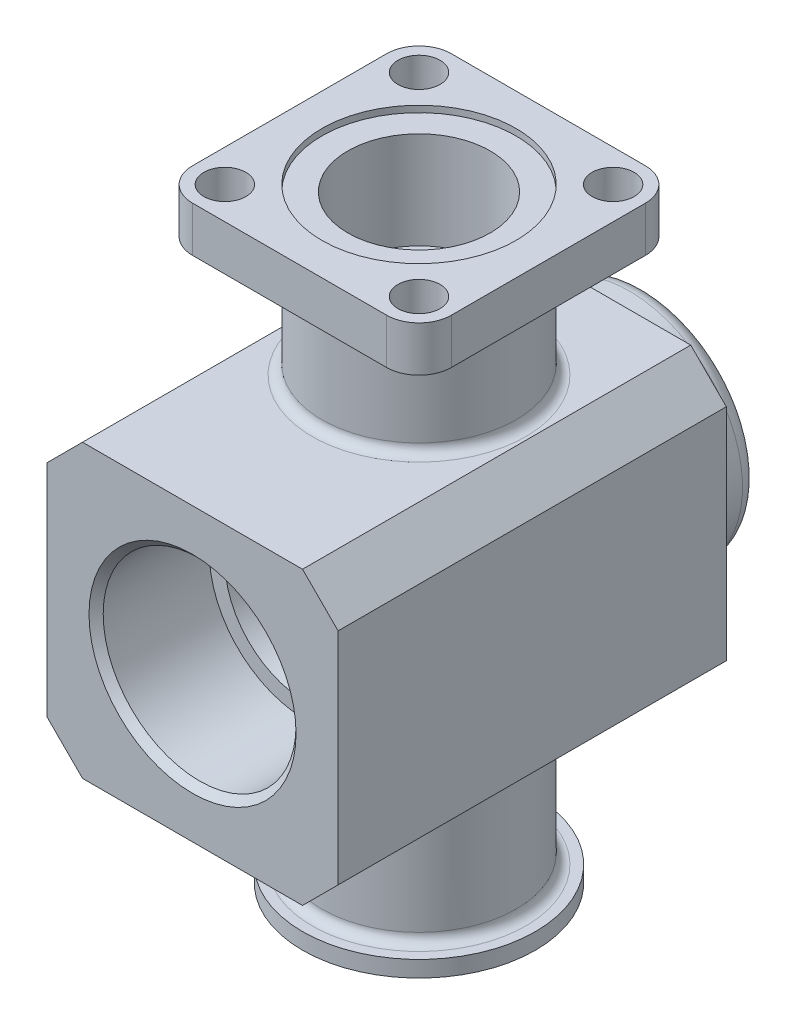
from build123d import *

# Parameters (mm, degrees)
SKETCH_1_W          = 90
SKETCH_1_H          = 90
EXTRUDE_1_DEPTH     = 120
SKETCH_9_R          = 35
EXTRUDE_6_DEPTH     = 20
SKETCH_2_R          = 30
EXTRUDE_2_DEPTH     = 51
SKETCH_3_W          = 80
SKETCH_3_H          = 80
EXTRUDE_3_DEPTH     = 14
EXTRUDE_START       = 46
SKETCH_4_R          = 30
EXTRUDE_4_DEPTH     = 46
SKETCH_5_R          = 36
EXTRUDE_5_DEPTH     = 5
SKETCH_6_R          = 15
CUT_EXTRUDE_1_DEPTH = 227.702448156
SKETCH_7_R          = 22
CUT_EXTRUDE_2_DEPTH = 32
SKETCH_8_R          = 22.352
CUT_EXTRUDE_3_DEPTH = 36
FILLET_1_R          = 10
SKETCH_10_R         = 6.5
CUT_EXTRUDE_4_DEPTH = 14
CHAMFER_1_SIZE      = 11
FILLET_2_R          = 5
SKETCH_11_R         = 29.805
CUT_EXTRUDE_5_DEPTH = 35
CHAMFER_2_SIZE      = 2.195
CUT_EXTRUDE_START   = -2
SKETCH_14_R         = 30
CUT_EXTRUDE_6_DEPTH = 2
FILLET_3_R          = 3
CHAMFER_4_SIZE      = 1.648


with BuildPart() as part:
    # Эскиз1 → Бобышка-Вытянуть1 (new body)
    with BuildSketch(Plane.XY):
        Rectangle(SKETCH_1_W, SKETCH_1_H)
    extrude(amount=EXTRUDE_1_DEPTH)

    # Эскиз9 → Бобышка-Вытянуть6 (add)
    with BuildSketch(Plane(origin=(0, 0, 0), x_dir=(-1, 0, 0), z_dir=(0, 0, -1))):
        Circle(SKETCH_9_R)
    extrude(amount=EXTRUDE_6_DEPTH)

    # Эскиз2 → Бобышка-Вытянуть2 (add)
    with BuildSketch(Plane(origin=(0, 45, 0), x_dir=(1, 0, 0), z_dir=(0, 1, 0))):
        with Locations(Location((0, -50, 0), (0, 0, 90))):
            Circle(SKETCH_2_R)
    extrude(amount=EXTRUDE_2_DEPTH)

    # Эскиз3 → Бобышка-Вытянуть3 (add)
    with BuildSketch(Plane(origin=(0, 96, 0), x_dir=(1, 0, 0), z_dir=(0, 1, 0))):
        with Locations((0, -50)):
            Rectangle(SKETCH_3_W, SKETCH_3_H)
    extrude(amount=-EXTRUDE_3_DEPTH)

    # Эскиз4 → Бобышка-Вытянуть4 (add)
    with BuildSketch(Plane.XZ.offset(45).offset(EXTRUDE_START)):
        with Locations(Location((0, 50, 0), (0, 0, 270))):
            Circle(SKETCH_4_R)
    extrude(amount=-EXTRUDE_4_DEPTH)

    # Эскиз5 → Бобышка-Вытянуть5 (add)
    with BuildSketch(Plane.XZ.offset(91)):
        with Locations(Location((0, 50, 0), (0, 0, 270))):
            Circle(SKETCH_5_R)
    extrude(amount=-EXTRUDE_5_DEPTH)

    # Эскиз6 → Вырез-Вытянуть1 (cut, through all)
    with BuildSketch(Plane(origin=(0, -91, 0), x_dir=(-1, 0, 0), z_dir=(0, -1, 0))):
        with Locations(Location((0, -50, 0), (0, 0, 90))):
            Circle(SKETCH_6_R)
    extrude(amount=-CUT_EXTRUDE_1_DEPTH, mode=Mode.SUBTRACT)

    # Эскиз7 → Вырез-Вытянуть2 (cut)
    with BuildSketch(Plane(origin=(0, 96, 0), x_dir=(1, 0, 0), z_dir=(0, 1, 0))):
        with Locations(Location((0, -50, 0), (0, 0, 270))):
            Circle(SKETCH_7_R)
    extrude(amount=-CUT_EXTRUDE_2_DEPTH, mode=Mode.SUBTRACT)

    # Эскиз8 → Вырез-Вытянуть3 (cut)
    with BuildSketch(Plane.XZ.offset(91)):
        with Locations(Location((0, 50, 0), (0, 0, 270))):
            Circle(SKETCH_8_R)
    extrude(amount=-CUT_EXTRUDE_3_DEPTH, mode=Mode.SUBTRACT)

    # Скругление1
    fillet_1_edges = [part.edges().sort_by_distance(p)[0] for p in [
        (40, 89, 10),
        (40, 89, 90),
        (-40, 89, 90),
        (-40, 89, 10),
    ]]
    fillet(fillet_1_edges, radius=FILLET_1_R)

    # Эскиз10 → Вырез-Вытянуть4 (cut)
    with BuildSketch(Plane(origin=(0, 96, 0), x_dir=(1, 0, 0), z_dir=(0, 1, 0))):
        with Locations(Location((-30, -20, 0), (0, 0, 270))):
            Circle(SKETCH_10_R)
        with Locations(Location((30, -80, 0), (0, 0, 90))):
            Circle(SKETCH_10_R)
        with Locations(Location((30, -20, 0), (0, 0, 270))):
            Circle(SKETCH_10_R)
        with Locations(Location((-30, -80, 0), (0, 0, 270))):
            Circle(SKETCH_10_R)
    extrude(amount=-CUT_EXTRUDE_4_DEPTH, mode=Mode.SUBTRACT)

    # Фаска1
    chamfer_1_edges = [part.edges().sort_by_distance(p)[0] for p in [
        (45, -45, 60),
        (-45, -45, 60),
        (-45, 45, 60),
        (45, 45, 60),
    ]]
    chamfer(chamfer_1_edges, length=CHAMFER_1_SIZE)

    # Скругление2
    fillet_2_edges = [part.edges().sort_by_distance(p)[0] for p in [
        (35, 0, 0),
        (35, 0, -20),
    ]]
    fillet(fillet_2_edges, radius=FILLET_2_R)

    # Эскиз11 → Вырез-Вытянуть5 (cut)
    with BuildSketch(Plane.XY.offset(120)):
        Circle(SKETCH_11_R)
    extrude(amount=-CUT_EXTRUDE_5_DEPTH, mode=Mode.SUBTRACT)

    # Эскиз13 → Вырез-Повернуть1 (revolve, cut)
    with BuildSketch(Plane(origin=(0, 0, 0), x_dir=(0, 0, -1), z_dir=(1, 0, 0))):
        Polygon((-85, 25), (5, 12.351324877), (5, 0), (-85, 0), align=None)
    revolve(axis=Axis((0, 0, 0), (0, 0, 1)), mode=Mode.SUBTRACT)

    # Фаска2
    chamfer_2_edges = [part.edges().sort_by_distance(p)[0] for p in [
        (-29.805, 0, 120),
    ]]
    chamfer(chamfer_2_edges, length=CHAMFER_2_SIZE)

    # Эскиз14 → Вырез-Вытянуть6 (cut)
    with BuildSketch(Plane(origin=(0, 96, 0), x_dir=(1, 0, 0), z_dir=(0, 1, 0)).offset(CUT_EXTRUDE_START)):
        with Locations(Location((0, -50, 0), (0, 0, 270))):
            Circle(SKETCH_14_R)
    extrude(amount=CUT_EXTRUDE_6_DEPTH, mode=Mode.SUBTRACT)

    # Скругление3
    fillet_3_edges = [part.edges().sort_by_distance(p)[0] for p in [
        (0, 45, 80),
        (0, 82, 80),
        (0, -45, 80),
        (0, -86, 80),
    ]]
    fillet(fillet_3_edges, radius=FILLET_3_R)

    # Фаска4
    chamfer_4_edges = [part.edges().sort_by_distance(p)[0] for p in [
        (0, -91, 72.352),
    ]]
    chamfer(chamfer_4_edges, length=CHAMFER_4_SIZE)


solid = part.part
